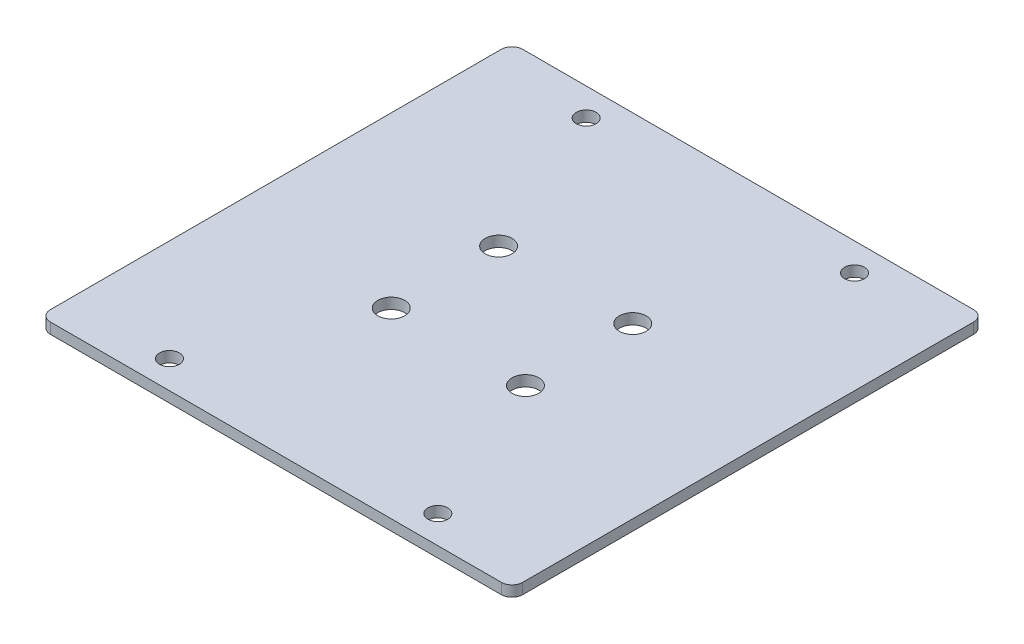
from build123d import *

# Parameters (mm, degrees)
SKETCH1_W           = 88
SKETCH1_H           = 88
BOSS_EXTRUDE1_DEPTH = 2
FILLET1_R           = 2
SKETCH3_R           = 1.85
CUT_EXTRUDE1_DEPTH  = 10
SKETCH4_R           = 2.5
CUT_EXTRUDE2_DEPTH  = 10


with BuildPart() as part:
    # Sketch1 → Boss-Extrude1 (new body)
    with BuildSketch(Plane(origin=(0, 0, 0), x_dir=(1, 0, 0), z_dir=(0, 1, 0))):
        Rectangle(SKETCH1_W, SKETCH1_H)
    extrude(amount=BOSS_EXTRUDE1_DEPTH)

    # Fillet1
    fillet1_edges = [part.edges().sort_by_distance(p)[0] for p in [
        (-44, 1, -44),
        (44, 1, -44),
        (44, 1, 44),
        (-44, 1, 44),
    ]]
    fillet(fillet1_edges, radius=FILLET1_R)

    # Sketch3 → Cut-Extrude1 (cut)
    with BuildSketch(Plane(origin=(0, 2, 0), x_dir=(1, 0, 0), z_dir=(0, 1, 0))):
        with Locations(Location((-25, 38.82, 0), (0, 0, 270))):
            Circle(SKETCH3_R)
        with Locations(Location((25, 38.82, 0), (0, 0, 270))):
            Circle(SKETCH3_R)
        with Locations(Location((-25, -38.82, 0), (0, 0, 270))):
            Circle(SKETCH3_R)
        with Locations(Location((25, -38.82, 0), (0, 0, 270))):
            Circle(SKETCH3_R)
    extrude(amount=-CUT_EXTRUDE1_DEPTH, mode=Mode.SUBTRACT)

    # Sketch4 → Cut-Extrude2 (cut)
    with BuildSketch(Plane(origin=(0, 2, 0), x_dir=(1, 0, 0), z_dir=(0, 1, 0))):
        with Locations(Location((-12.5, 10, 0), (0, 0, 270))):
            Circle(SKETCH4_R)
        with Locations(Location((-12.5, -10, 0), (0, 0, 270))):
            Circle(SKETCH4_R)
        with Locations(Location((12.5, -10, 0), (0, 0, 270))):
            Circle(SKETCH4_R)
        with Locations(Location((12.5, 10, 0), (0, 0, 270))):
            Circle(SKETCH4_R)
    extrude(amount=-CUT_EXTRUDE2_DEPTH, mode=Mode.SUBTRACT)


solid = part.part
